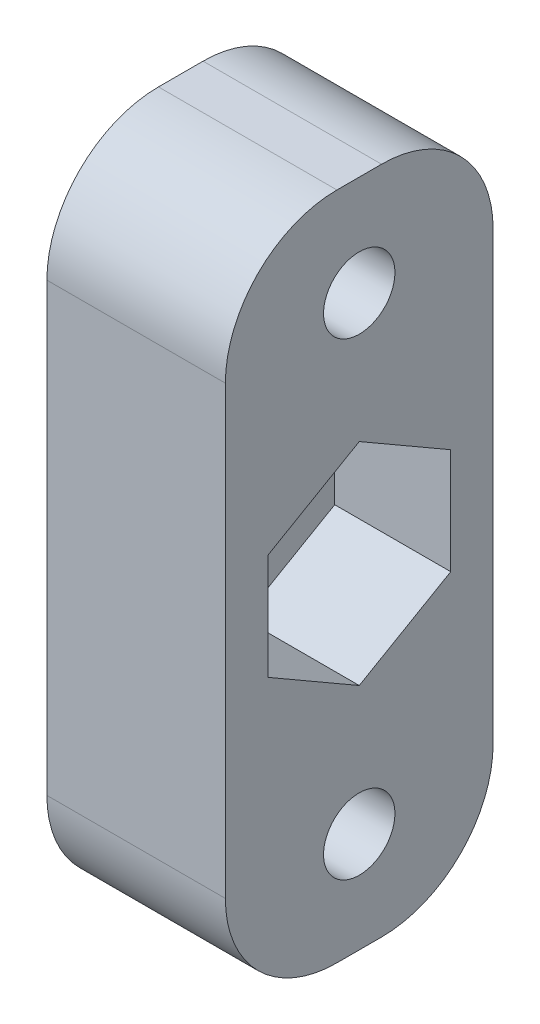
from build123d import *

# Parameters (mm, degrees)
SKIZZE1_W                       = 8
SKIZZE1_H                       = 30
AUFSATZ_LINEAR_AUSTRAGEN1_DEPTH = 6
SCHNITT_LINEAR_AUSTRAGEN3_DEPTH = 5.2
SCHNITT_LINEAR_START            = -8
SCHNITT_LINEAR_AUSTRAGEN2_DEPTH = 5.2
SKIZZE4_R                       = 1.6
SKIZZE4_R_2                     = 2.6
SCHNITT_LINEAR_AUSTRAGEN4_DEPTH = 19.027756377
VERRUNDUNG1_R                   = 5


with BuildPart() as part:
    # Skizze1 → Aufsatz-Linear austragen1 (new, symmetric)
    with BuildSketch(Plane.XY):
        with Locations((-4, 0)):
            Rectangle(SKIZZE1_W, SKIZZE1_H)
    extrude(amount=AUFSATZ_LINEAR_AUSTRAGEN1_DEPTH, both=True)

    # Skizze2 → Schnitt-Linear austragen3 (cut)
    with BuildSketch(Plane(origin=(0, 0, 0), x_dir=(0, 0, -1), z_dir=(1, 0, 0))):
        Polygon((0, 4.734272207), (-4.1, 2.367136104), (-4.1, -2.367136104), (0, -4.734272207), (4.1, -2.367136104), (4.1, 2.367136104), align=None)
    extrude(amount=-SCHNITT_LINEAR_AUSTRAGEN3_DEPTH, mode=Mode.SUBTRACT)

    # Skizze3 → Schnitt-Linear austragen2 (cut)
    with BuildSketch(Plane(origin=(0, 0, 0), x_dir=(0, 0, -1), z_dir=(1, 0, 0)).offset(SCHNITT_LINEAR_START)):
        Polygon((2.85, 8.854551733), (2.85, 12.145448267), (0, 13.790896534), (-2.85, 12.145448267), (-2.85, 8.854551733), (0, 7.209103466), align=None)
    schnitt_linear_austragen2 = extrude(amount=SCHNITT_LINEAR_AUSTRAGEN2_DEPTH, mode=Mode.SUBTRACT)

    # Skizze4 → Schnitt-Linear austragen4 (cut, through all)
    with BuildSketch(Plane(origin=(0, 0, 0), x_dir=(0, 0, -1), z_dir=(1, 0, 0))):
        with Locations((0, 10.5)):
            Circle(SKIZZE4_R)
        with Locations((0, -10.5)):
            Circle(SKIZZE4_R)
        Circle(SKIZZE4_R_2)
    extrude(amount=-SCHNITT_LINEAR_AUSTRAGEN4_DEPTH, mode=Mode.SUBTRACT)

    # Spiegeln1: Schnitt-Linear austragen2 across plane
    add(schnitt_linear_austragen2.mirror(Plane.ZX), mode=Mode.SUBTRACT)

    # Verrundung1
    verrundung1_edges = [part.edges().sort_by_distance(p)[0] for p in [
        (-4, -15, 6),
        (-4, -15, -6),
        (-4, 15, -6),
        (-4, 15, 6),
    ]]
    fillet(verrundung1_edges, radius=VERRUNDUNG1_R)


solid = part.part
